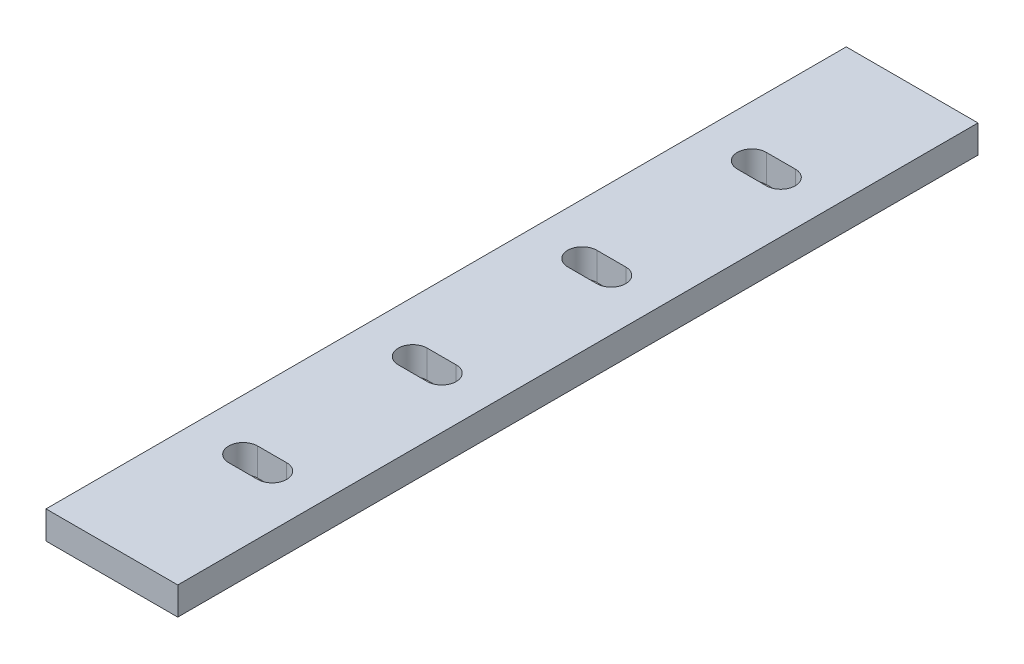
from build123d import *

# Parameters (mm, degrees)
SKETCH2_W           = 15
SKETCH2_H           = 91.1
BOSS_EXTRUDE1_DEPTH = 3.175


with BuildPart() as part:
    # Sketch2 → Boss-Extrude1 (new body)
    with BuildSketch(Plane(origin=(0, 0, 0), x_dir=(1, 0, 0), z_dir=(0, 1, 0))):
        with Locations((7.5, 45.55)):
            Rectangle(SKETCH2_W, SKETCH2_H)
        with BuildLine():
            Line((9.15, 14.95), (5.85, 14.95))
            ThreePointArc((5.85, 14.95), (4.2, 16.6), (5.85, 18.25))
            Line((5.85, 18.25), (9.15, 18.25))
            ThreePointArc((9.15, 18.25), (10.8, 16.6), (9.15, 14.95))
        make_face(mode=Mode.SUBTRACT)
        with BuildLine():
            Line((9.15, 34.25), (5.85, 34.25))
            ThreePointArc((5.85, 34.25), (4.2, 35.9), (5.85, 37.55))
            Line((5.85, 37.55), (9.15, 37.55))
            ThreePointArc((9.15, 37.55), (10.8, 35.9), (9.15, 34.25))
        make_face(mode=Mode.SUBTRACT)
        with BuildLine():
            Line((9.15, 53.55), (5.85, 53.55))
            ThreePointArc((5.85, 53.55), (4.2, 55.2), (5.85, 56.85))
            Line((5.85, 56.85), (9.15, 56.85))
            ThreePointArc((9.15, 56.85), (10.8, 55.2), (9.15, 53.55))
        make_face(mode=Mode.SUBTRACT)
        with BuildLine():
            Line((9.15, 72.85), (5.85, 72.85))
            ThreePointArc((5.85, 72.85), (4.2, 74.5), (5.85, 76.15))
            Line((5.85, 76.15), (9.15, 76.15))
            ThreePointArc((9.15, 76.15), (10.8, 74.5), (9.15, 72.85))
        make_face(mode=Mode.SUBTRACT)
    extrude(amount=BOSS_EXTRUDE1_DEPTH)


solid = part.part
